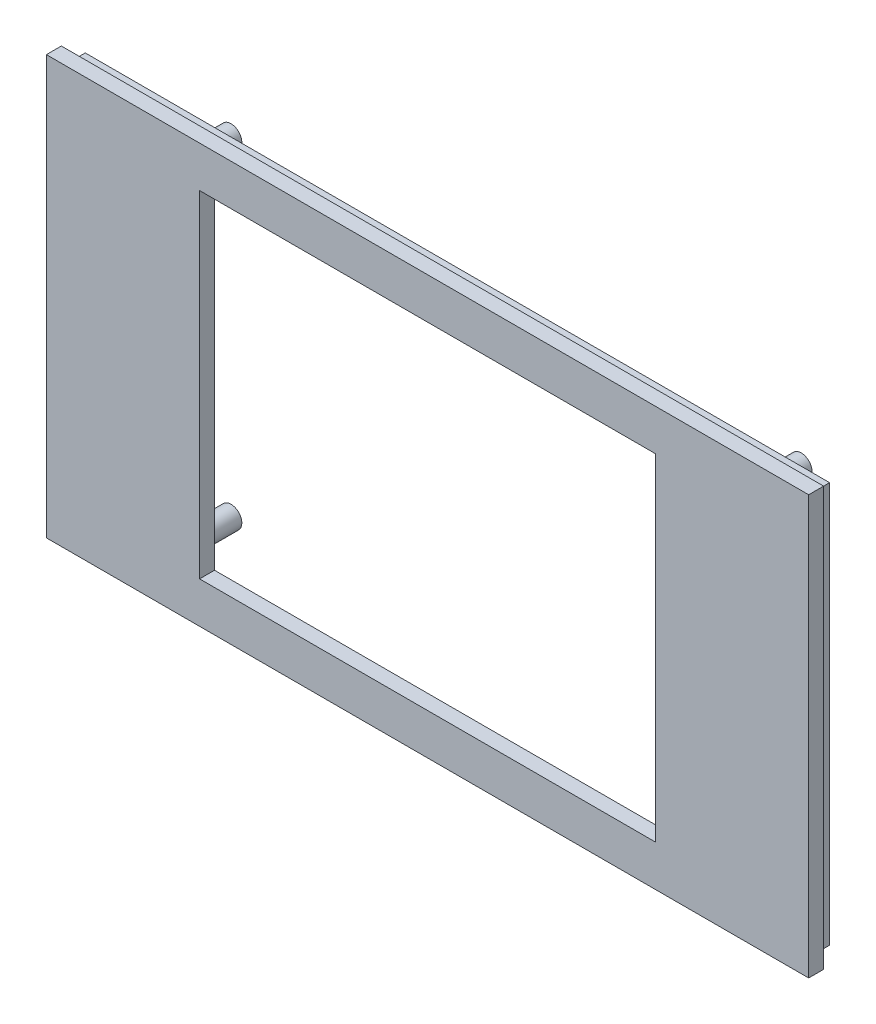
from build123d import *

# Parameters (mm, degrees)
SKETCH1_W         = 102
SKETCH1_H         = 56
SKETCH1_W_2       = 61
SKETCH1_H_2       = 45
FRONT_DEPTH       = 2
SKETCH2_W         = 99.6
SKETCH2_H         = 53.6
SKETCH2_W_2       = 97.2
SKETCH2_H_2       = 51.2
WALLS_DEPTH       = 2
SKETCH3_R         = 1.45
SCREW_SPOTS_DEPTH = 7


with BuildPart() as part:
    # Sketch1 → Front (new body)
    with BuildSketch(Plane.XY):
        Rectangle(SKETCH1_W, SKETCH1_H)
        Rectangle(SKETCH1_W_2, SKETCH1_H_2, mode=Mode.SUBTRACT)
    extrude(amount=FRONT_DEPTH)

    # Sketch2 → WALLS (add)
    with BuildSketch(Plane(origin=(0, 0, 0), x_dir=(-1, 0, 0), z_dir=(0, 0, -1))):
        Rectangle(SKETCH2_W, SKETCH2_H)
        Rectangle(SKETCH2_W_2, SKETCH2_H_2, mode=Mode.SUBTRACT)
    extrude(amount=WALLS_DEPTH)

    # Sketch3 → SCREW_SPOTS (add)
    with BuildSketch(Plane(origin=(0, 0, 0), x_dir=(-1, 0, 0), z_dir=(0, 0, -1))):
        with Locations((-41, 21.9)):
            Circle(SKETCH3_R)
        with Locations((35.3, 21.9)):
            Circle(SKETCH3_R)
        with Locations((-41, -22.2)):
            Circle(SKETCH3_R)
        with Locations((35.3, -22.2)):
            Circle(SKETCH3_R)
    extrude(amount=SCREW_SPOTS_DEPTH)


solid = part.part
